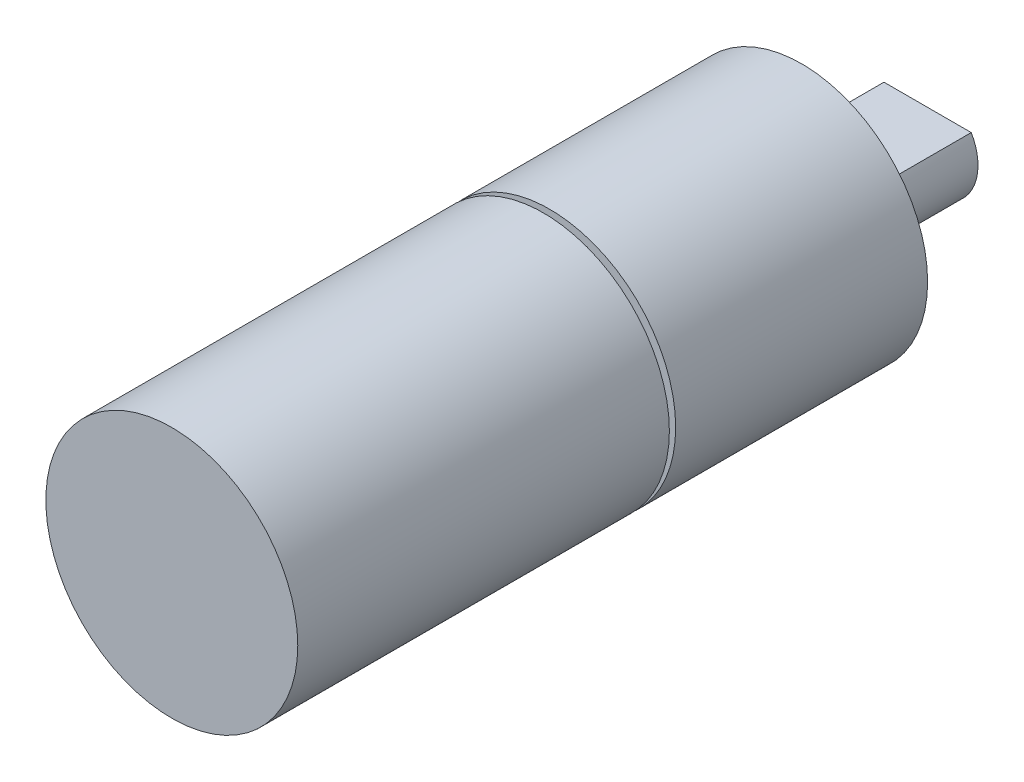
from build123d import *

# Parameters (mm, degrees)
CUT_EXTRUDE1_DEPTH = 15
CUT_EXTRUDE2_START = -40
SKETCH3_R          = 20
SKETCH3_R_2        = 18.5
CUT_EXTRUDE2_DEPTH = 1


with BuildPart() as part:
    # Sketch1 → Revolve1 (revolve)
    with BuildSketch(Plane(origin=(0, 0, 0), x_dir=(0, 0, -1), z_dir=(1, 0, 0)), mode=Mode.PRIVATE) as revolve1_sk:
        Polygon((0, 0), (0, 20), (100, 20), (100, 8), (120, 8), (120, 0), align=None)
    revolve(revolve1_sk.sketch.rotate(Axis((0, 0, 24.465289117), (0, 0, -1)), 90), axis=Axis((0, 0, 24.465289117), (0, 0, -1)))

    # Sketch2 → Cut-Extrude1 (cut)
    with BuildSketch(Plane(origin=(0, 0, -120), x_dir=(-1, 0, 0), z_dir=(0, 0, -1))):
        with BuildLine():
            Line((-6.92820323, 4), (6.92820323, 4))
            ThreePointArc((6.92820323, 4), (0, 8), (-6.92820323, 4))
        make_face()
    extrude(amount=-CUT_EXTRUDE1_DEPTH, mode=Mode.SUBTRACT)

    # Sketch3 → Cut-Extrude2 (cut)
    with BuildSketch(Plane(origin=(0, 0, -100), x_dir=(-1, 0, 0), z_dir=(0, 0, -1)).offset(CUT_EXTRUDE2_START)):
        with Locations(Location((0, 0, 0), (0, 0, 180))):
            Circle(SKETCH3_R)
        Circle(SKETCH3_R_2, mode=Mode.SUBTRACT)
    extrude(amount=-CUT_EXTRUDE2_DEPTH, mode=Mode.SUBTRACT)


solid = part.part
